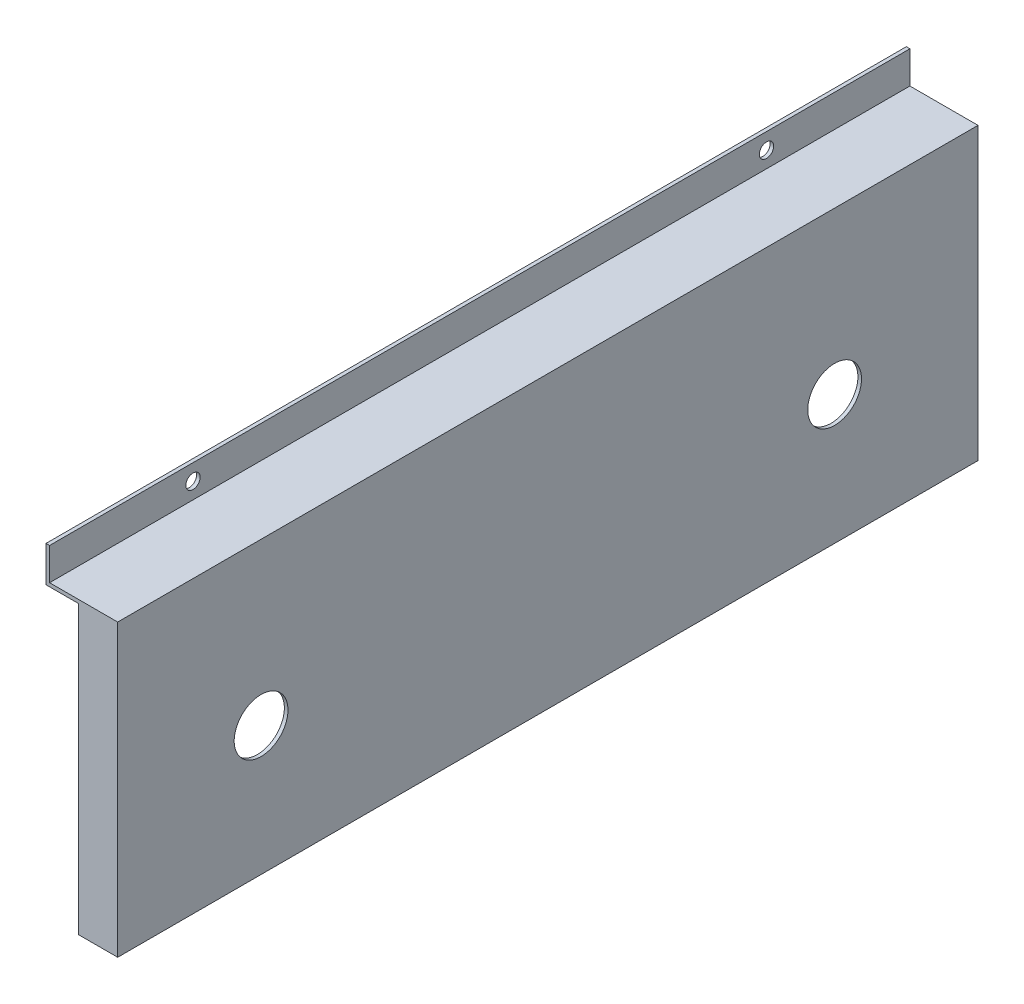
from build123d import *

# Parameters (mm, degrees)
CROQUIS1_W              = 20
CROQUIS1_H              = 100
SALIENTE_EXTRUIR1_DEPTH = 240
CROQUIS2_W              = 19
CROQUIS2_H              = 9
CORTAR_EXTRUIR1_DEPTH   = 240
CROQUIS3_R              = 2
CROQUIS3_W              = 238
CROQUIS3_H              = 90
CORTAR_EXTRUIR2_DEPTH   = 19
CROQUIS4_W              = 1
CROQUIS4_H              = 90
CORTAR_EXTRUIR3_DEPTH   = 9
CROQUIS5_R              = 7.5
CROQUIS5_W              = 240
CROQUIS5_H              = 10
CORTAR_EXTRUIR5_DEPTH   = 20


with BuildPart() as part:
    # Croquis1 → Saliente-Extruir1 (new body)
    with BuildSketch(Plane.XY):
        with Locations((7.330646947, -26.197398527)):
            Rectangle(CROQUIS1_W, CROQUIS1_H)
    extrude(amount=SALIENTE_EXTRUIR1_DEPTH)

    # Croquis2 → Cortar-Extruir1 (cut)
    with BuildSketch(Plane.XY.offset(240)):
        with Locations((7.830646947, 19.302601473)):
            Rectangle(CROQUIS2_W, CROQUIS2_H)
    extrude(amount=-CORTAR_EXTRUIR1_DEPTH, mode=Mode.SUBTRACT)

    # Croquis3 → Cortar-Extruir2 (cut)
    with BuildSketch(Plane.ZY.offset(2.669353053)):
        with Locations((40, 19.302601473)):
            Circle(CROQUIS3_R)
        with Locations((200, 19.302601473)):
            Circle(CROQUIS3_R)
        with Locations((120, -31.197398527)):
            Rectangle(CROQUIS3_W, CROQUIS3_H)
    extrude(amount=-CORTAR_EXTRUIR2_DEPTH, mode=Mode.SUBTRACT)

    # Croquis4 → Cortar-Extruir3 (cut)
    with BuildSketch(Plane.ZY.offset(2.669353053)):
        with Locations((0.5, -31.197398527)):
            Rectangle(CROQUIS4_W, CROQUIS4_H)
        with Locations((239.5, -31.197398527)):
            Rectangle(CROQUIS4_W, CROQUIS4_H)
    extrude(amount=-CORTAR_EXTRUIR3_DEPTH, mode=Mode.SUBTRACT)

    # Croquis5 → Cortar-Extruir5 (cut)
    with BuildSketch(Plane(origin=(17.330646947, 0, 0), x_dir=(0, 0, -1), z_dir=(1, 0, 0))):
        with Locations((-200, -30.197398527)):
            Circle(CROQUIS5_R)
        with Locations((-40, -30.197398527)):
            Circle(CROQUIS5_R)
        with Locations((-120, -71.197398527)):
            Rectangle(CROQUIS5_W, CROQUIS5_H)
    extrude(amount=-CORTAR_EXTRUIR5_DEPTH, mode=Mode.SUBTRACT)


solid = part.part
